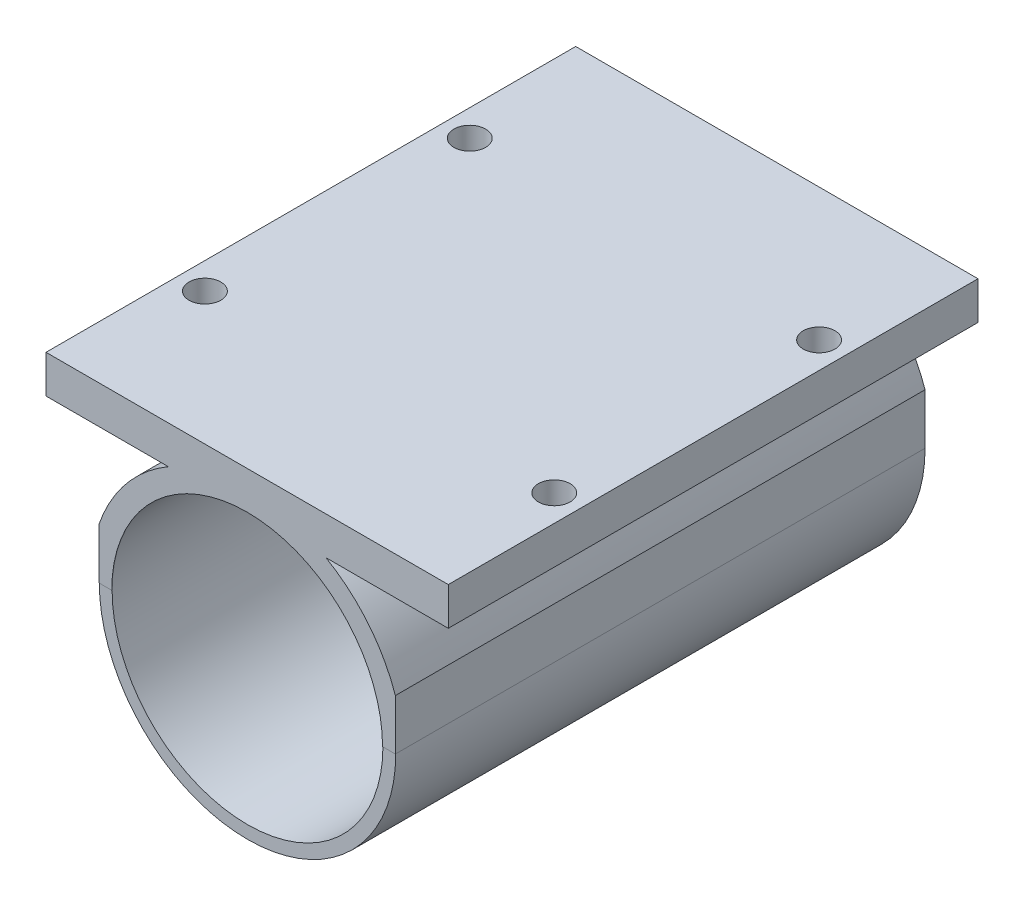
from build123d import *

# Parameters (mm, degrees)
SKETCH1_R           = 14
BOSS_EXTRUDE1_DEPTH = 50
SKETCH5_W           = 28
SKETCH5_H           = 50.034880911
BOSS_EXTRUDE2_DEPTH = 21
SKETCH2_R           = 12.791811967
CUT_EXTRUDE1_DEPTH  = 48
SKETCH3_R           = 4
CUT_EXTRUDE2_DEPTH  = 49
SKETCH4_R           = 1.5
CUT_EXTRUDE3_DEPTH  = 49
SKETCH6_R           = 12.79
CUT_EXTRUDE5_DEPTH  = 21
SKETCH7_W           = 28
SKETCH7_H           = 4.634699127
CUT_EXTRUDE6_DEPTH  = 53
SKETCH8_W           = 50.034880911
SKETCH8_H           = 3.58
BOSS_EXTRUDE3_DEPTH = 5
SKETCH13_R          = 1.5
CUT_EXTRUDE7_DEPTH  = 5
SKETCH14_W          = 50.034880911
SKETCH14_H          = 3.58
BOSS_EXTRUDE4_DEPTH = 5
SKETCH15_R          = 1.5
CUT_EXTRUDE8_DEPTH  = 5
FILLET1_R           = 1
FILLET2_R           = 1
CUT_EXTRUDE9_DEPTH  = 73


with BuildPart() as part:
    # Sketch1 → Boss-Extrude1 (new body)
    with BuildSketch(Plane.XY):
        with Locations(Location((0, 0, 0), (0, 0, 180))):
            Circle(SKETCH1_R)
    extrude(amount=BOSS_EXTRUDE1_DEPTH)

    # Sketch5 → Boss-Extrude2 (add)
    with BuildSketch(Plane(origin=(0, 0, 0), x_dir=(1, 0, 0), z_dir=(0, 1, 0))):
        with Locations((0, -25.017440456)):
            Rectangle(SKETCH5_W, SKETCH5_H)
    extrude(amount=BOSS_EXTRUDE2_DEPTH)

    # Sketch2 → Cut-Extrude1 (cut)
    with BuildSketch(Plane.XY.offset(50)):
        Circle(SKETCH2_R)
    extrude(amount=-CUT_EXTRUDE1_DEPTH, mode=Mode.SUBTRACT)

    # Sketch3 → Cut-Extrude2 (cut)
    with BuildSketch(Plane(origin=(0, 0, 0), x_dir=(-1, 0, 0), z_dir=(0, 0, -1))):
        Circle(SKETCH3_R)
    extrude(amount=-CUT_EXTRUDE2_DEPTH, mode=Mode.SUBTRACT)

    # Sketch4 → Cut-Extrude3 (cut)
    with BuildSketch(Plane(origin=(0, 0, 0), x_dir=(-1, 0, 0), z_dir=(0, 0, -1))):
        with Locations((0, -8.5)):
            Circle(SKETCH4_R)
        with Locations((0, 8.5)):
            Circle(SKETCH4_R)
        with Locations((8.5, 0)):
            Circle(SKETCH4_R)
        with Locations((-8.5, 0)):
            Circle(SKETCH4_R)
    extrude(amount=-CUT_EXTRUDE3_DEPTH, mode=Mode.SUBTRACT)

    # Sketch6 → Cut-Extrude5 (cut)
    with BuildSketch(Plane.XY.offset(50.034880911)):
        Circle(SKETCH6_R)
    extrude(amount=-CUT_EXTRUDE5_DEPTH, mode=Mode.SUBTRACT)

    # Sketch7 → Cut-Extrude6 (cut)
    with BuildSketch(Plane.XY.offset(50.034880911)):
        with Locations((0, 18.682650437)):
            Rectangle(SKETCH7_W, SKETCH7_H)
    extrude(amount=-CUT_EXTRUDE6_DEPTH, mode=Mode.SUBTRACT)

    # Sketch8 → Boss-Extrude3 (add)
    with BuildSketch(Plane(origin=(14, 0, 0), x_dir=(0, 0, -1), z_dir=(1, 0, 0))):
        with Locations((-25.017440456, 14.575300873)):
            Rectangle(SKETCH8_W, SKETCH8_H)
    extrude(amount=BOSS_EXTRUDE3_DEPTH)

    # Sketch13 → Cut-Extrude7 (cut)
    with BuildSketch(Plane.XZ.offset(-12.785300873)):
        with Locations(Location((16.5, 37.526160683, 0), (0, 0, 270))):
            Circle(SKETCH13_R)
        with Locations(Location((16.5, 12.508720228, 0), (0, 0, 270))):
            Circle(SKETCH13_R)
    extrude(amount=-CUT_EXTRUDE7_DEPTH, mode=Mode.SUBTRACT)

    # Sketch14 → Boss-Extrude4 (add)
    with BuildSketch(Plane.ZY.offset(14)):
        with Locations((25.017440456, 14.575300873)):
            Rectangle(SKETCH14_W, SKETCH14_H)
    extrude(amount=BOSS_EXTRUDE4_DEPTH)

    # Sketch15 → Cut-Extrude8 (cut)
    with BuildSketch(Plane.XZ.offset(-12.785300873)):
        with Locations(Location((-16.5, 12.508720228, 0), (0, 0, 270))):
            Circle(SKETCH15_R)
        with Locations(Location((-16.5, 37.526160683, 0), (0, 0, 270))):
            Circle(SKETCH15_R)
    extrude(amount=-CUT_EXTRUDE8_DEPTH, mode=Mode.SUBTRACT)

    # Fillet1
    fillet1_edges = [part.edges().sort_by_distance(p)[0] for p in [
        (10, 0, 0),
    ]]
    fillet(fillet1_edges, radius=FILLET1_R)

    # Fillet2
    fillet2_edges = [part.edges().sort_by_distance(p)[0] for p in [
        (1.5, -8.5, 0),
        (1.5, 8.5, 0),
        (-7, 0, 0),
    ]]
    fillet(fillet2_edges, radius=FILLET2_R)

    # Sketch16 → Cut-Extrude9 (cut)
    with BuildSketch(Plane(origin=(0, 0, 0), x_dir=(-1, 0, 0), z_dir=(0, 0, -1))):
        with BuildLine():
            Line((-7.445480913, 12.785300873), (-14, 12.785300873))
            Line((-14, 12.785300873), (-14, 4.785300873))
            ThreePointArc((-14, 4.785300873), (-11.444525455, 9.376670067), (-7.445480913, 12.785300873))
        make_face()
        with BuildLine():
            Line((14, 12.785300873), (14, 4.785300873))
            ThreePointArc((14, 4.785300873), (11.444525455, 9.376670067), (7.445480913, 12.785300873))
            Line((7.445480913, 12.785300873), (14, 12.785300873))
        make_face()
    extrude(amount=-CUT_EXTRUDE9_DEPTH, mode=Mode.SUBTRACT)


solid = part.part
